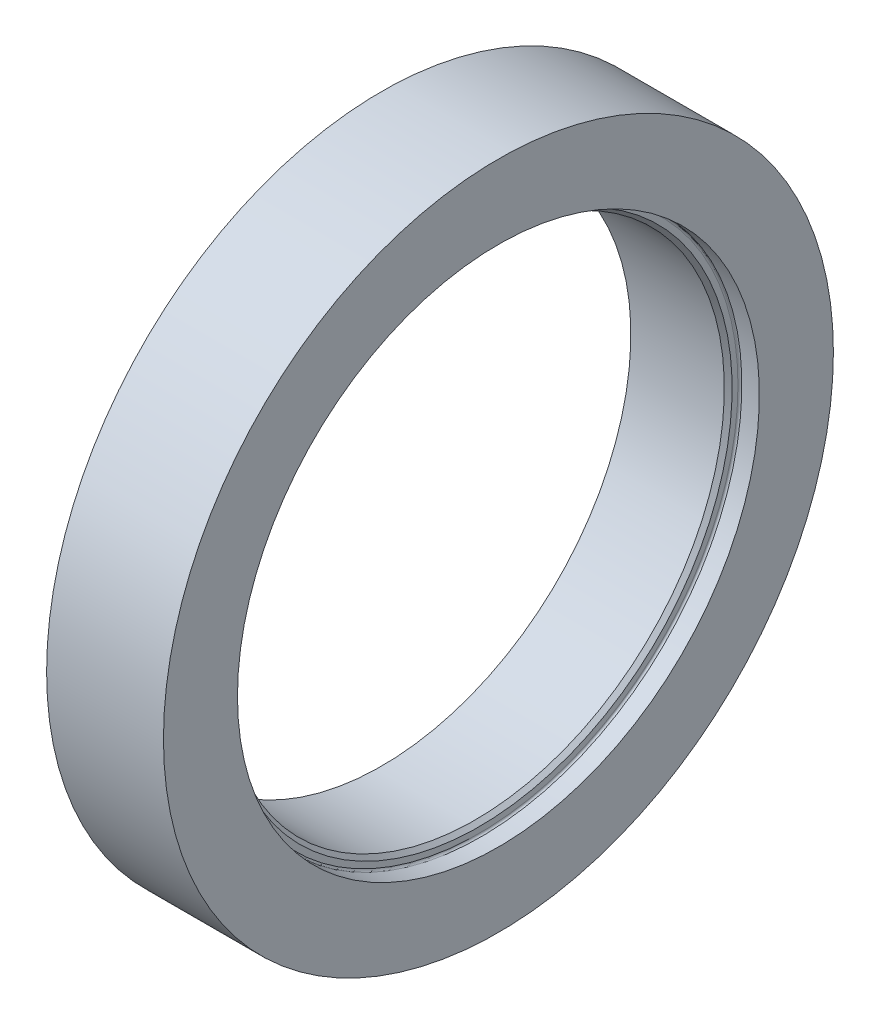
from build123d import *


with BuildPart() as part:
    # Эскиз1 → Повернуть1 (revolve)
    with BuildSketch(Plane.XY, mode=Mode.PRIVATE) as revolve_1_sk:
        with BuildLine():
            Line((0, 64), (0, 86))
            Line((0, 86), (30, 86))
            Line((30, 86), (30, 67))
            Line((30, 67), (25.5, 67))
            ThreePointArc((25.5, 67), (25.146446609, 66.853553391), (25, 66.5))
            Line((25, 66.5), (25, 65))
            Line((25, 65), (24, 64))
            Line((24, 64), (0, 64))
        make_face()
    revolve(revolve_1_sk.sketch.rotate(Axis((0, 0, 0), (1, 0, 0)), 90), axis=Axis((0, 0, 0), (1, 0, 0)))


solid = part.part
